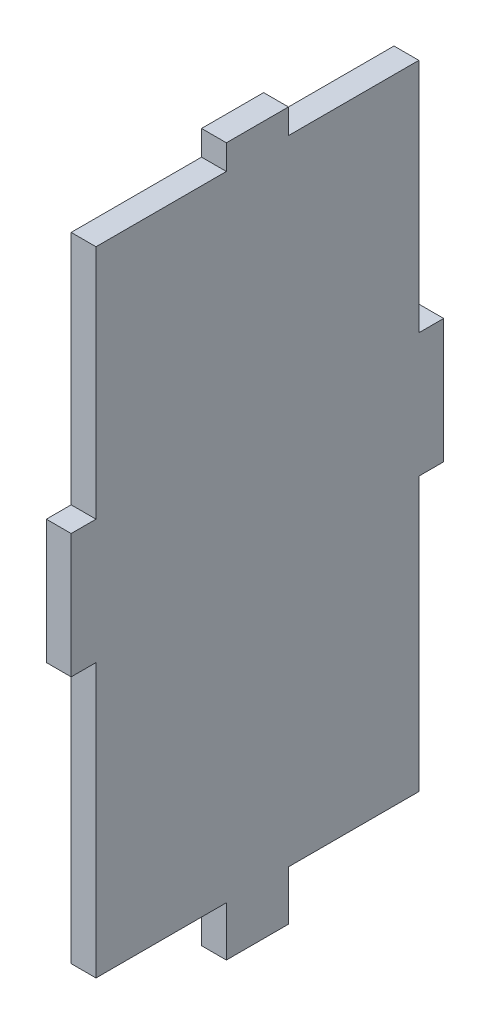
from build123d import *

# Parameters (mm, degrees)
BOSS_EXTRUDE1_DEPTH = 2


with BuildPart() as part:
    # Sketch1 → Boss-Extrude1 (new body)
    with BuildSketch(Plane(origin=(0, 0, 0), x_dir=(0, 0, -1), z_dir=(1, 0, 0))):
        Polygon((0, 0), (10.5, 0), (10.5, -4), (15.5, -4), (15.5, 0), (26, 0), (26, 22), (28, 22), (28, 32), (26, 32), (26, 51), (15.5, 51), (15.5, 53), (10.5, 53), (10.5, 51), (0, 51), (0, 32), (-2, 32), (-2, 22), (0, 22), align=None)
    extrude(amount=BOSS_EXTRUDE1_DEPTH)


solid = part.part
